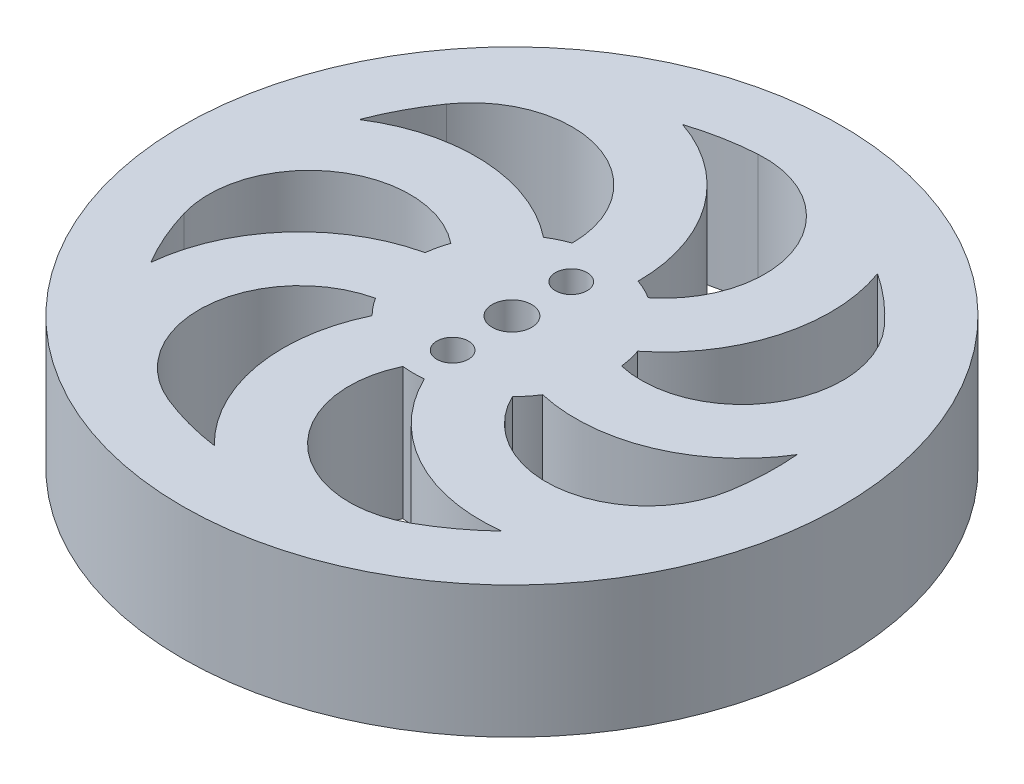
from build123d import *

# Parameters (mm, degrees)
BASE_REFERENCE_SKETCH_R       = 25
BASE_REFERENCE_SKETCH_R_2     = 1.5
BASE_WHEEL_EXTRUDE_DEPTH      = 10
SPOKES_CIRCULAR_PATTERN_COUNT = 7
M2_CLEARANCE_HOLE1_D          = 2.4
CIRPATTERN1_COUNT             = 2


with BuildPart() as part:
    # Base Reference Sketch → Base Wheel Extrude (new body)
    with BuildSketch(Plane(origin=(0, 0, 0), x_dir=(1, 0, 0), z_dir=(0, 1, 0))):
        with Locations(Location((0, 0, 0), (0, 0, 270))):
            Circle(BASE_REFERENCE_SKETCH_R)
        with BuildLine():
            ThreePointArc((-6.099694515, 19.047144847), (11.877442501, -16.091188882), (-16.404494382, 11.440828819))
            ThreePointArc((-16.404494382, 11.440828819), (-7.848653173, 14.358553237), (-2.5, 7.071067812))
            ThreePointArc((-2.5, 7.071067812), (0, -7.5), (2.5, 7.071067812))
            ThreePointArc((2.5, 7.071067812), (0.127377259, 14.442993729), (-6.099694515, 19.047144847))
        make_face(mode=Mode.SUBTRACT)
        with Locations(Location((0, 0, 0), (0, 0, 270))):
            Circle(BASE_REFERENCE_SKETCH_R_2, mode=Mode.SUBTRACT)
    base_wheel_extrude = extrude(amount=BASE_WHEEL_EXTRUDE_DEPTH)

    # Spokes Circular Pattern: Base Wheel Extrude ×7 about axis
    spokes_circular_pattern_axis = Axis((0, 0, 0), (0, 1, 0))
    for i in range(1, SPOKES_CIRCULAR_PATTERN_COUNT):
        add(base_wheel_extrude.rotate(spokes_circular_pattern_axis, i * 360 / SPOKES_CIRCULAR_PATTERN_COUNT))

    # M2 Clearance Hole1 (through all)
    with Locations(Plane(origin=(0, 0, 0), x_dir=(-1, 0, 0), z_dir=(0, -1, 0))):
        with Locations((0, 4.5)):
            m2_clearance_hole1 = Hole(M2_CLEARANCE_HOLE1_D / 2)

    # CirPattern1: M2 Clearance Hole1 ×2 about axis
    cirpattern1_axis = Axis((0, 0, 0), (0, 1, 0))
    for i in range(1, CIRPATTERN1_COUNT):
        add(m2_clearance_hole1.rotate(cirpattern1_axis, i * 360 / CIRPATTERN1_COUNT), mode=Mode.SUBTRACT)


solid = part.part
